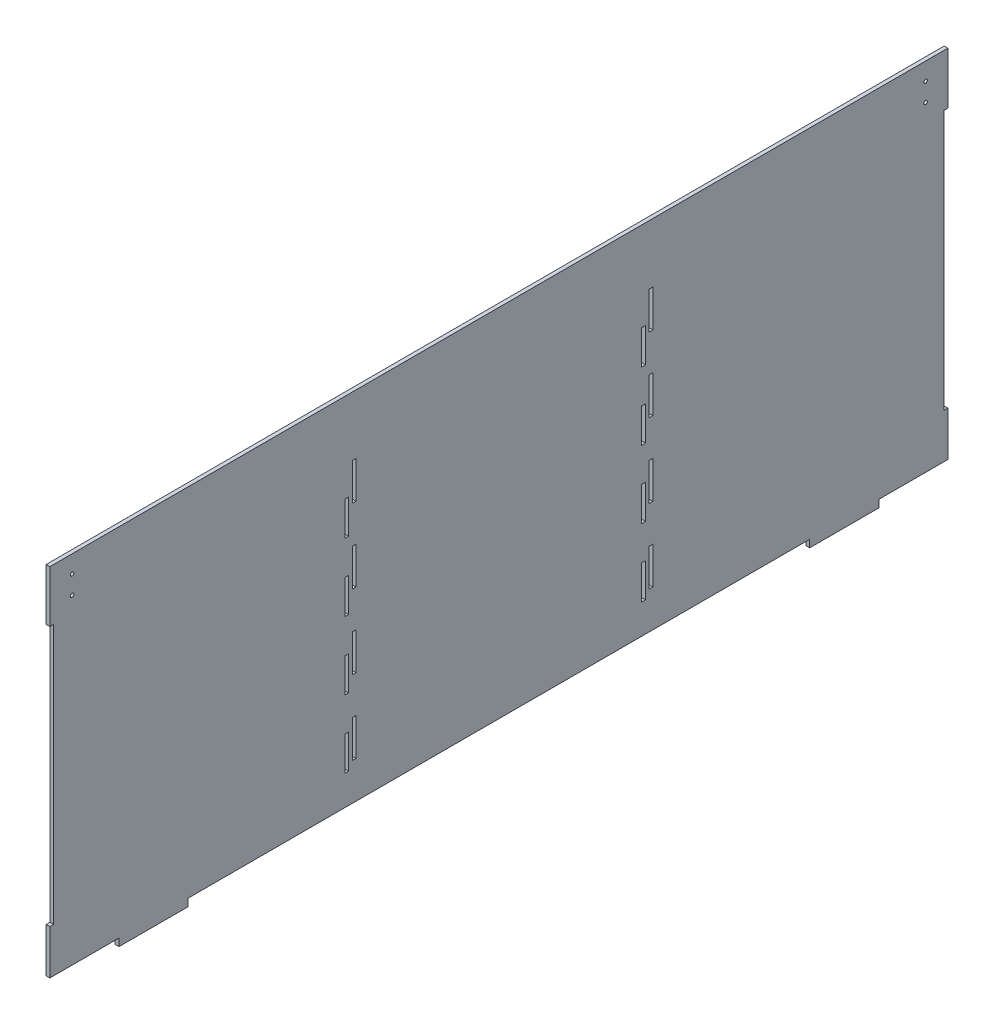
from build123d import *

# Parameters (mm, degrees)
BOSS_EXTRUDE1_DEPTH = 3.175
SKETCH3_W           = 3.175
SKETCH3_H           = 31.75
SKETCH3_H_2         = 29.028571429
CUT_EXTRUDE1_DEPTH  = 416.694688143
SKETCH4_R           = 1.5
CUT_EXTRUDE2_DEPTH  = 3.175
SKETCH5_W           = 3.175
SKETCH5_H           = 44.45
SKETCH5_W_2         = 59.103846153
SKETCH5_H_2         = 6.35
SKETCH5_W_3         = 59.103846154
CUT_EXTRUDE3_DEPTH  = 3.175


with BuildPart() as part:
    # Sketch1 → Boss-Extrude1 (new body)
    with BuildSketch(Plane(origin=(0, 0, 0), x_dir=(0, 0, -1), z_dir=(1, 0, 0))):
        Polygon((-384.175, 152.4), (-384.175, 107.95), (-381, 107.95), (-381, 63.5), (-384.175, 63.5), (-384.175, 19.05), (-381, 19.05), (-381, -25.4), (-384.175, -25.4), (-384.175, -69.85), (-381, -69.85), (-381, -114.3), (-384.175, -114.3), (-384.175, -152.4), (-325.071153846, -152.4), (-325.071153846, -158.75), (-265.967307692, -158.75), (-265.967307692, -152.4), (-206.863461538, -152.4), (-206.863461538, -158.75), (-147.759615385, -158.75), (-147.759615385, -152.4), (-88.655769231, -152.4), (-88.655769231, -158.75), (-29.551923077, -158.75), (-29.551923077, -152.4), (29.551923077, -152.4), (29.551923077, -158.75), (88.655769231, -158.75), (88.655769231, -152.4), (147.759615385, -152.4), (147.759615385, -158.75), (206.863461538, -158.75), (206.863461538, -152.4), (265.967307692, -152.4), (265.967307692, -158.75), (325.071153846, -158.75), (325.071153846, -152.4), (384.175, -152.4), (384.175, -114.3), (381, -114.3), (381, -69.85), (384.175, -69.85), (384.175, -25.4), (381, -25.4), (381, 19.05), (384.175, 19.05), (384.175, 63.5), (381, 63.5), (381, 107.95), (384.175, 107.95), (384.175, 152.4), align=None)
    extrude(amount=BOSS_EXTRUDE1_DEPTH)

    # Sketch3 → Cut-Extrude1 (cut, through all)
    with BuildSketch(Plane(origin=(3.175, 0, 0), x_dir=(0, 0, -1), z_dir=(1, 0, 0))):
        with Locations((-123.823769685, -104.775)):
            Rectangle(SKETCH3_W, SKETCH3_H)
        with Locations((-123.823769685, -41.275)):
            Rectangle(SKETCH3_W, SKETCH3_H)
        with Locations((-123.823769685, 22.225)):
            Rectangle(SKETCH3_W, SKETCH3_H)
        with Locations((-123.823769685, 85.725)):
            Rectangle(SKETCH3_W, SKETCH3_H)
        with Locations((-130.176230315, 61.685714285)):
            Rectangle(SKETCH3_W, SKETCH3_H_2)
        with Locations((-130.176230315, 3.628571428)):
            Rectangle(SKETCH3_W, SKETCH3_H_2)
        with Locations((-130.176230315, -54.428571428)):
            Rectangle(SKETCH3_W, SKETCH3_H_2)
        with Locations((-130.176230315, -112.485714286)):
            Rectangle(SKETCH3_W, SKETCH3_H_2)
        with Locations((130.176230315, 85.725)):
            Rectangle(SKETCH3_W, SKETCH3_H)
        with Locations((123.823769685, 61.685714285)):
            Rectangle(SKETCH3_W, SKETCH3_H_2)
        with Locations((130.176230315, 22.225)):
            Rectangle(SKETCH3_W, SKETCH3_H)
        with Locations((123.823769685, 3.628571428)):
            Rectangle(SKETCH3_W, SKETCH3_H_2)
        with Locations((130.176230315, -41.275)):
            Rectangle(SKETCH3_W, SKETCH3_H)
        with Locations((123.823769685, -54.428571428)):
            Rectangle(SKETCH3_W, SKETCH3_H_2)
        with Locations((130.176230315, -104.775)):
            Rectangle(SKETCH3_W, SKETCH3_H)
        with Locations((123.823769685, -112.485714286)):
            Rectangle(SKETCH3_W, SKETCH3_H_2)
    extrude(amount=-CUT_EXTRUDE1_DEPTH, mode=Mode.SUBTRACT)

    # Sketch4 → Cut-Extrude2 (cut)
    with BuildSketch(Plane(origin=(3.175, 0, 0), x_dir=(0, 0, -1), z_dir=(1, 0, 0))):
        with Locations((-365.125, 137.4)):
            Circle(SKETCH4_R)
        with Locations((-365.125, 121.65)):
            Circle(SKETCH4_R)
        with Locations((365.125, 137.4)):
            Circle(SKETCH4_R)
        with Locations((365.125, 121.65)):
            Circle(SKETCH4_R)
    extrude(amount=-CUT_EXTRUDE2_DEPTH, mode=Mode.SUBTRACT)

    # Sketch5 → Cut-Extrude3 (cut)
    with BuildSketch(Plane(origin=(3.175, 0, 0), x_dir=(0, 0, -1), z_dir=(1, 0, 0))):
        with Locations((-382.5875, 41.275)):
            Rectangle(SKETCH5_W, SKETCH5_H)
        with Locations((-382.5875, -47.625)):
            Rectangle(SKETCH5_W, SKETCH5_H)
        with Locations((-177.311538462, -155.575)):
            Rectangle(SKETCH5_W_2, SKETCH5_H_2)
        with Locations((-59.103846154, -155.575)):
            Rectangle(SKETCH5_W_3, SKETCH5_H_2)
        with Locations((59.103846154, -155.575)):
            Rectangle(SKETCH5_W_3, SKETCH5_H_2)
        with Locations((177.311538462, -155.575)):
            Rectangle(SKETCH5_W_2, SKETCH5_H_2)
        with Locations((382.5875, -47.625)):
            Rectangle(SKETCH5_W, SKETCH5_H)
        with Locations((382.5875, 41.275)):
            Rectangle(SKETCH5_W, SKETCH5_H)
    extrude(amount=-CUT_EXTRUDE3_DEPTH, mode=Mode.SUBTRACT)


solid = part.part
